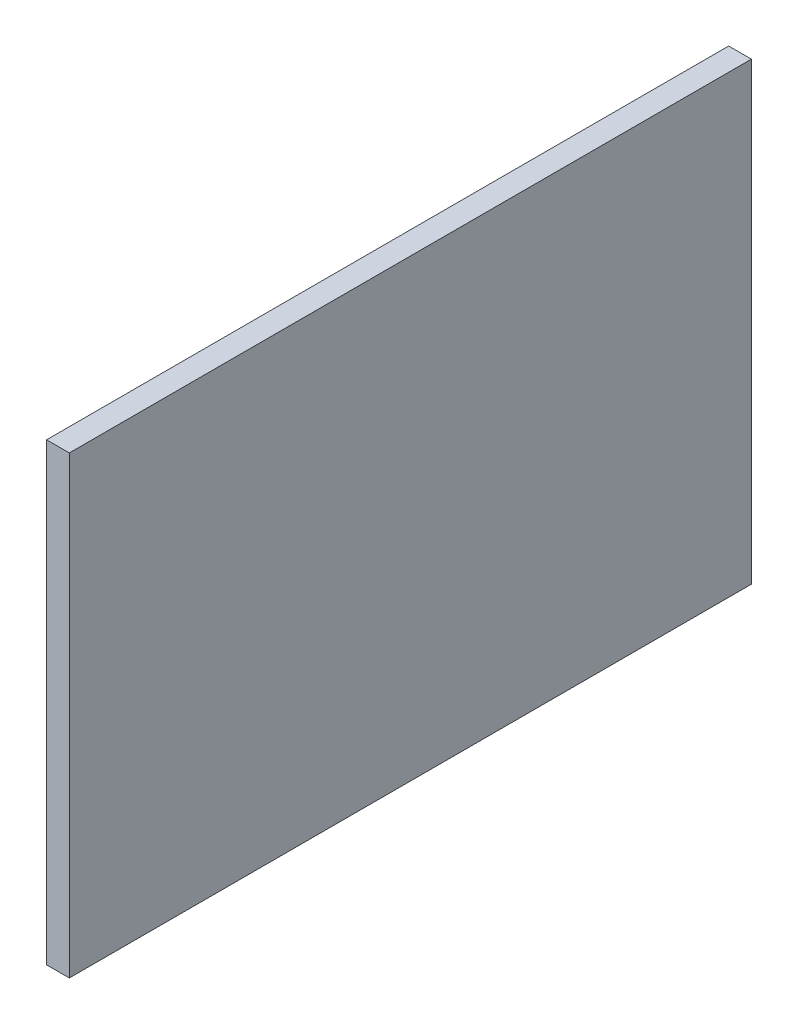
from build123d import *

# Parameters (mm, degrees)
CROQUIS2_W              = 10
CROQUIS2_H              = 200
SALIENTE_EXTRUIR1_DEPTH = 300


with BuildPart() as part:
    # Croquis2 → Saliente-Extruir1 (new body)
    with BuildSketch(Plane.XY):
        with Locations((5, 100)):
            Rectangle(CROQUIS2_W, CROQUIS2_H)
    extrude(amount=SALIENTE_EXTRUIR1_DEPTH)


solid = part.part
